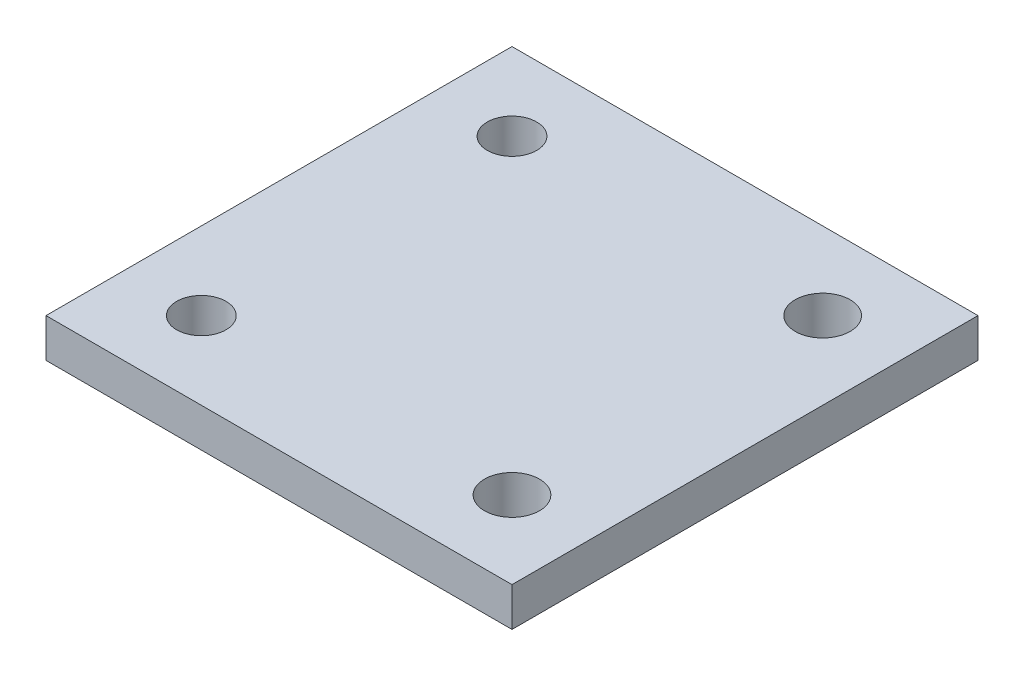
from build123d import *

# Parameters (mm, degrees)
SKETCH1_W              = 38.1
SKETCH1_H              = 38.1
BOSS_EXTRUDE1_DEPTH    = 1.5875
F_10_32_TAPPED_HOLE1_D = 4.0386
F_8_CLEARANCE_HOLE1_D  = 4.4958


with BuildPart() as part:
    # Sketch1 → Boss-Extrude1 (new, symmetric)
    with BuildSketch(Plane(origin=(0, 0, 0), x_dir=(1, 0, 0), z_dir=(0, 1, 0))):
        Rectangle(SKETCH1_W, SKETCH1_H)
    extrude(amount=BOSS_EXTRUDE1_DEPTH, both=True)

    # #10-32 Tapped Hole1 (through all)
    with Locations(Plane(origin=(0, 1.5875, 0), x_dir=(1, 0, 0), z_dir=(0, 1, 0))):
        with Locations((-12.7, 12.7), (-12.7, -12.7)):
            Hole(F_10_32_TAPPED_HOLE1_D / 2)

    # #8 Clearance Hole1 (through all)
    with Locations(Plane(origin=(0, 1.5875, 0), x_dir=(1, 0, 0), z_dir=(0, 1, 0))):
        with Locations((12.7, 12.7), (12.7, -12.7)):
            Hole(F_8_CLEARANCE_HOLE1_D / 2)


solid = part.part
